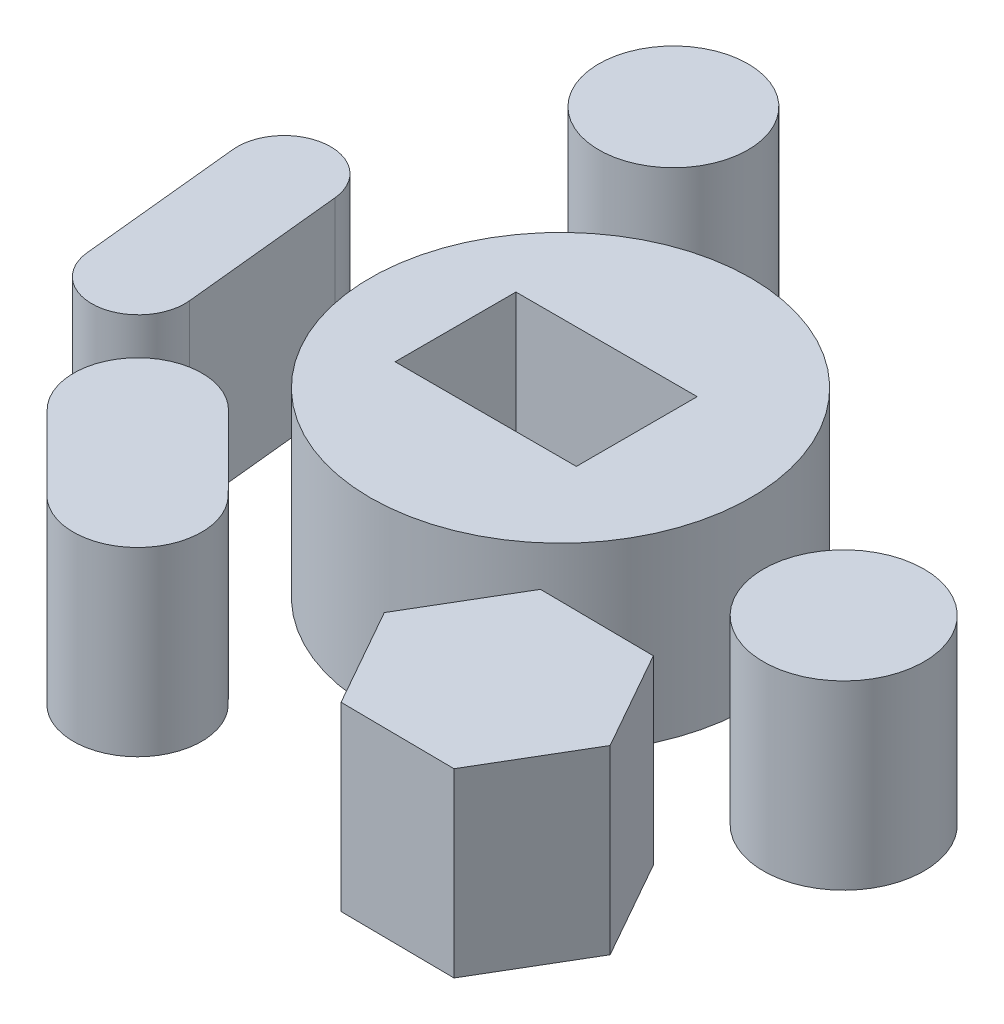
from build123d import *

# Parameters (mm, degrees)
SKETCH1_R             = 160.054383024
SKETCH1_W             = 152.4
SKETCH1_H             = 101.6
BOSS_EXTRUDE1_DEPTH   = 152.4
SKETCH1_R_2           = 67.546599545
BOSS_EXTRUDE1_2_DEPTH = 152.4
SKETCH1_R_3           = 62.72842728
BOSS_EXTRUDE1_3_DEPTH = 152.4
BOSS_EXTRUDE1_4_DEPTH = 152.4
BOSS_EXTRUDE1_5_DEPTH = 152.4
BOSS_EXTRUDE1_6_DEPTH = 152.4


with BuildPart() as part:
    # Sketch1 → Boss-Extrude1 (new body)
    with BuildSketch(Plane(origin=(0, 0, 0), x_dir=(1, 0, 0), z_dir=(0, 1, 0))):
        with Locations(Location((88.50543124, 50.578437179, 0), (0, 0, 90))):
            Circle(SKETCH1_R)
        with Locations((76.2, 50.8)):
            Rectangle(SKETCH1_W, SKETCH1_H, mode=Mode.SUBTRACT)
    extrude(amount=BOSS_EXTRUDE1_DEPTH)


with BuildPart() as body_2:
    # Sketch1 → Boss-Extrude1 2 (new body)
    with BuildSketch(Plane(origin=(0, 0, 0), x_dir=(1, 0, 0), z_dir=(0, 1, 0))):
        with Locations(Location((373.289947205, 3.911024814, 0), (0, 0, 90))):
            Circle(SKETCH1_R_2)
    extrude(amount=BOSS_EXTRUDE1_2_DEPTH)


with BuildPart() as body_3:
    # Sketch1 → Boss-Extrude1 3 (new body)
    with BuildSketch(Plane(origin=(0, 0, 0), x_dir=(1, 0, 0), z_dir=(0, 1, 0))):
        with Locations(Location((-68.638535942, 302.643214026, 0), (0, 0, 90))):
            Circle(SKETCH1_R_3)
    extrude(amount=BOSS_EXTRUDE1_3_DEPTH)


with BuildPart() as body_4:
    # Sketch1 → Boss-Extrude1 4 (new body)
    with BuildSketch(Plane(origin=(0, 0, 0), x_dir=(1, 0, 0), z_dir=(0, 1, 0))):
        Polygon((225.22648648, -270.660475239), (321.088205207, -271.580508421), (369.815836678, -189.021841345), (322.681749423, -105.543141086), (226.820030696, -104.623107904), (178.092399225, -187.18177498), align=None)
    extrude(amount=BOSS_EXTRUDE1_4_DEPTH)


with BuildPart() as body_5:
    # Sketch1 → Boss-Extrude1 5 (new body)
    with BuildSketch(Plane(origin=(0, 0, 0), x_dir=(1, 0, 0), z_dir=(0, 1, 0))):
        with BuildLine():
            Line((-144.715826236, 94.276120946), (-130.873948783, -42.06424919))
            ThreePointArc((-130.873948783, -42.06424919), (-165.942443278, -85.057964519), (-208.936158607, -49.989470025))
            Line((-208.936158607, -49.989470025), (-222.77803606, 86.350900111))
            ThreePointArc((-222.77803606, 86.350900111), (-187.709541566, 129.344615441), (-144.715826236, 94.276120946))
        make_face()
    extrude(amount=BOSS_EXTRUDE1_5_DEPTH)


with BuildPart() as body_6:
    # Sketch1 → Boss-Extrude1 6 (new body)
    with BuildSketch(Plane(origin=(0, 0, 0), x_dir=(1, 0, 0), z_dir=(0, 1, 0))):
        with BuildLine():
            Line((-49.404670277, -243.481375716), (-111.18669851, -181.436163559))
            ThreePointArc((-111.18669851, -181.436163559), (-111.024576314, -105.15816066), (-34.746573415, -105.320282856))
            Line((-34.746573415, -105.320282856), (27.035454818, -167.365495014))
            ThreePointArc((27.035454818, -167.365495014), (26.873332621, -243.643497912), (-49.404670277, -243.481375716))
        make_face()
    extrude(amount=BOSS_EXTRUDE1_6_DEPTH)


solid = Compound([part.part, body_2.part, body_3.part, body_4.part, body_5.part, body_6.part])
